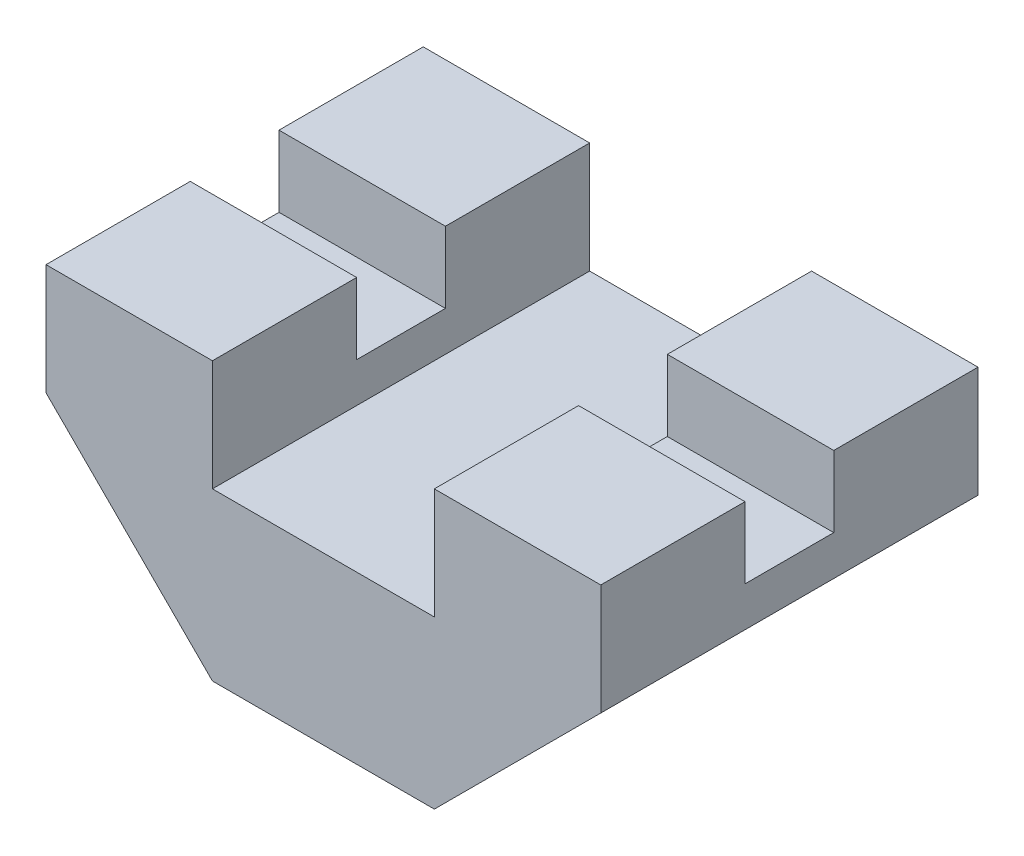
from build123d import *

# Parameters (mm, degrees)
Y_KSEKLIK_EKSTR_ZYON1_DEPTH = 1727.2
IZIM2_W                     = 406.4
IZIM2_H                     = 325.903885585
KES_EKSTR_ZYON1_DEPTH       = 3169.288470046


with BuildPart() as part:
    # Çizim1 → Yükseklik-Ekstrüzyon1 (new body)
    with BuildSketch(Plane.XY):
        Polygon((-448.962557604, 776.680107527), (313.037442396, 776.680107527), (313.037442396, 268.680107527), (-448.962557604, -493.319892473), (-1464.962557604, -493.319892473), (-2226.962557604, 268.680107527), (-2226.962557604, 776.680107527), (-1464.962557604, 776.680107527), (-1464.962557604, 268.680107527), (-448.962557604, 268.680107527), align=None)
    extrude(amount=Y_KSEKLIK_EKSTR_ZYON1_DEPTH)

    # Çizim2 → Kes-Ekstrüzyon1 (cut, through all)
    with BuildSketch(Plane(origin=(313.037442396, 0, 0), x_dir=(0, 0, -1), z_dir=(1, 0, 0))):
        with Locations((-863.6, 613.728164735)):
            Rectangle(IZIM2_W, IZIM2_H)
    extrude(amount=-KES_EKSTR_ZYON1_DEPTH, mode=Mode.SUBTRACT)


solid = part.part
